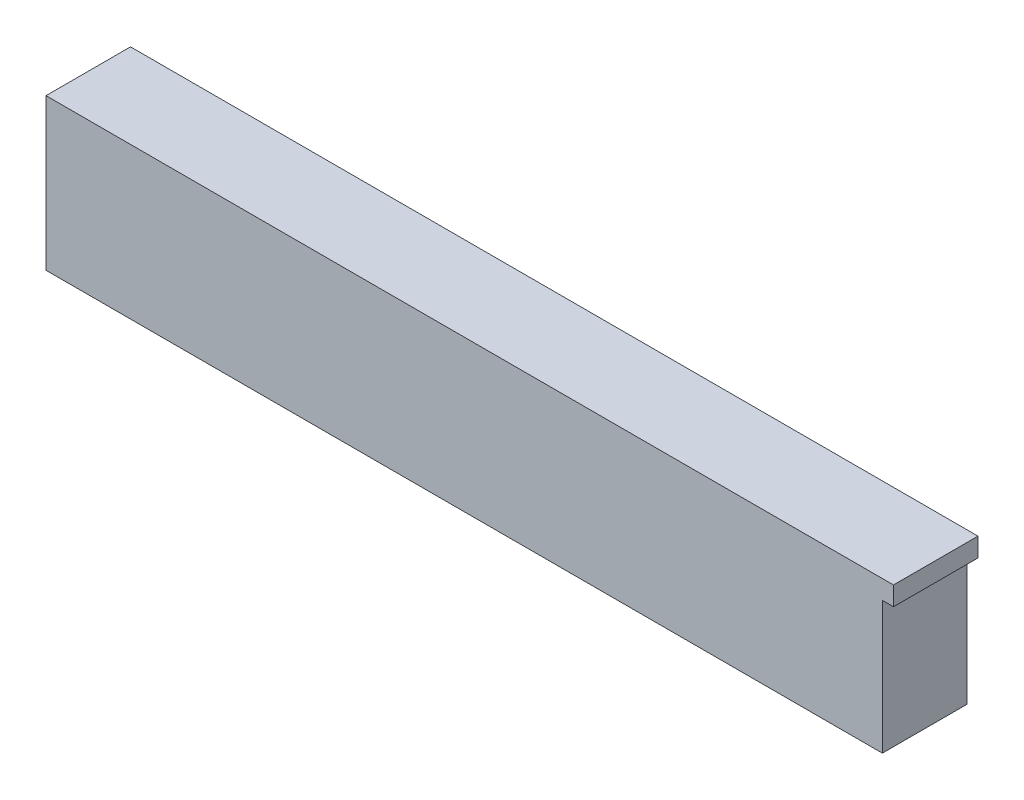
from build123d import *

# Parameters (mm, degrees)
SKETCH1_W           = 376
SKETCH1_H           = 68
BOSS_EXTRUDE1_DEPTH = 38
SKETCH2_W           = 38
SKETCH2_H           = 8.5
BOSS_EXTRUDE2_DEPTH = 5


with BuildPart() as part:
    # Sketch1 → Boss-Extrude1 (new body)
    with BuildSketch(Plane.XY):
        with Locations((188, 34)):
            Rectangle(SKETCH1_W, SKETCH1_H)
    extrude(amount=BOSS_EXTRUDE1_DEPTH)

    # Sketch2 → Boss-Extrude2 (add)
    with BuildSketch(Plane(origin=(376, 0, 0), x_dir=(0, 0, -1), z_dir=(1, 0, 0))):
        with Locations((-19, 63.75)):
            Rectangle(SKETCH2_W, SKETCH2_H)
    extrude(amount=BOSS_EXTRUDE2_DEPTH)


solid = part.part
